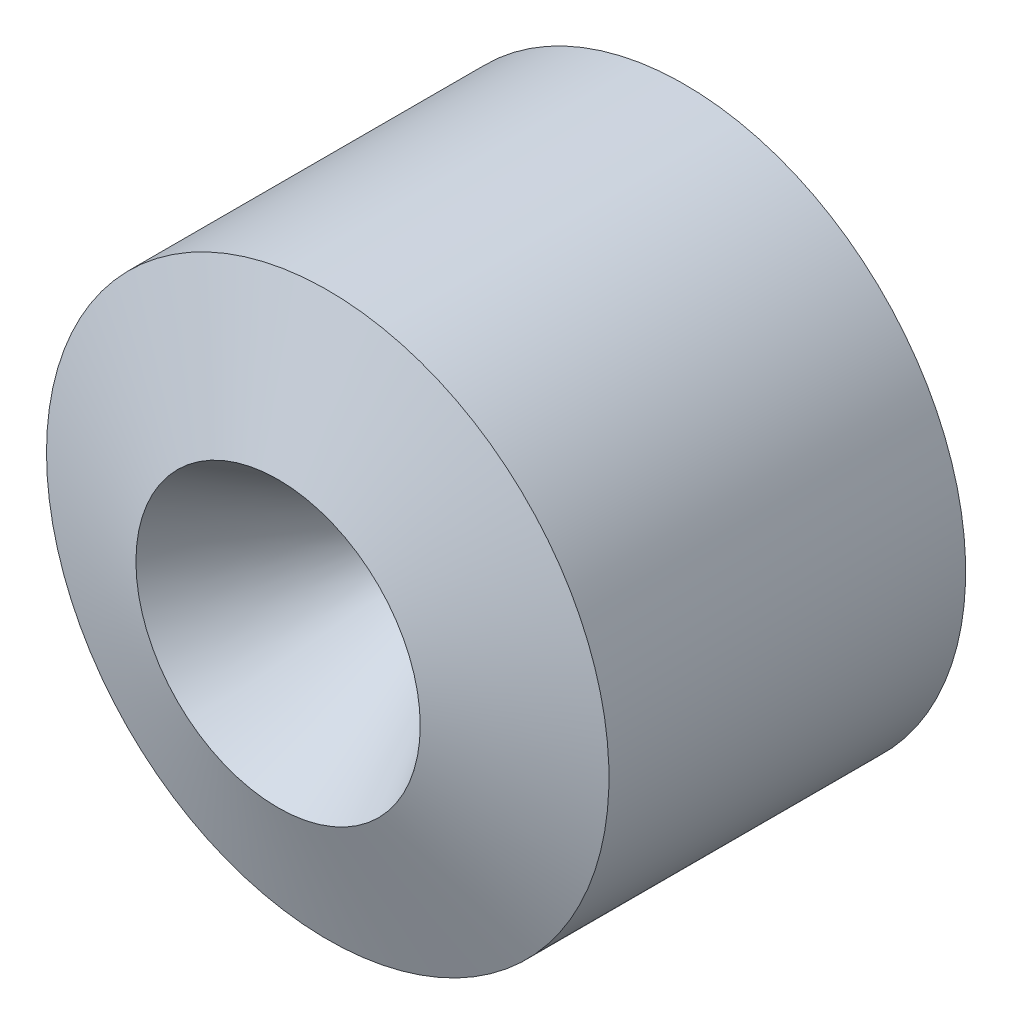
from build123d import *


with BuildPart() as part:
    # Sketch1 → Revolve1 (revolve)
    with BuildSketch(Plane(origin=(0, 0, 0), x_dir=(0, 0, -1), z_dir=(1, 0, 0)), mode=Mode.PRIVATE) as revolve1_sk:
        Polygon((0, 0), (-13.937488, 8.493506), (-10.97026, 16.803624), (10.341356, 16.803624), (10.341356, 0), align=None)
    revolve(revolve1_sk.sketch.rotate(Axis((0, 0, -10.341356), (0, 0, 1)), 90), axis=Axis((0, 0, -10.341356), (0, 0, 1)))


solid = part.part
